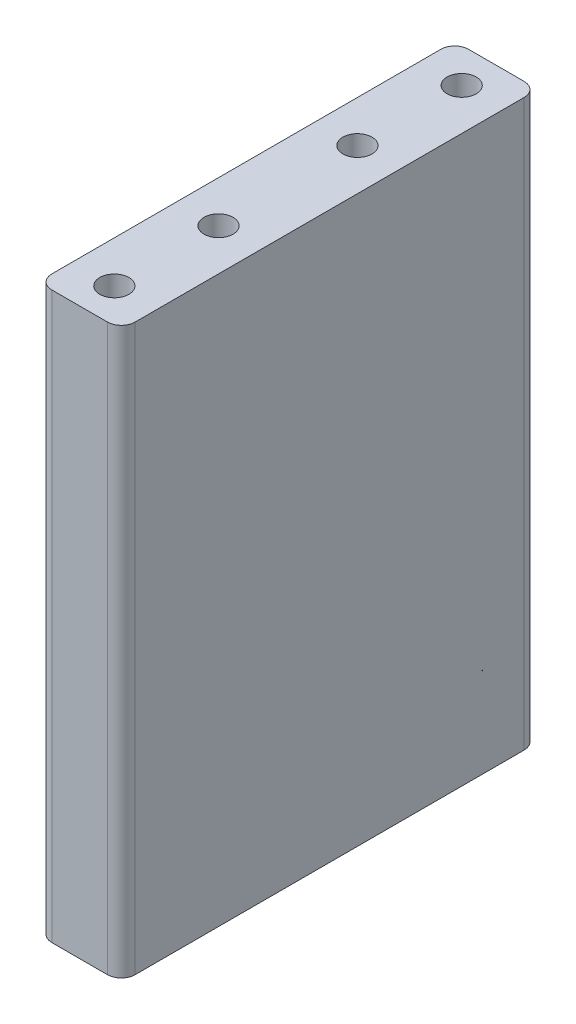
from build123d import *

# Parameters (mm, degrees)
SKETCH1_W                   = 12
SKETCH1_H                   = 60
BOSS_EXTRUDE1_DEPTH         = 81.375
TAP_DRILL_FOR_M5X0_8_TAP1_D = 4.2
FILLET1_R                   = 2


with BuildPart() as part:
    # Sketch1 → Boss-Extrude1 (new body)
    with BuildSketch(Plane(origin=(0, 0, 0), x_dir=(1, 0, 0), z_dir=(0, 1, 0))):
        Rectangle(SKETCH1_W, SKETCH1_H)
    extrude(amount=-BOSS_EXTRUDE1_DEPTH)

    # Tap Drill for M5x0.8 Tap1 (through all)
    with Locations(Plane(origin=(0, 0, -10), x_dir=(0, 0, 1), z_dir=(0, 1, 0))):
        with Locations((0, 0), (20, 0), (-15, 0), (35, 0)):
            Hole(TAP_DRILL_FOR_M5X0_8_TAP1_D / 2)

    # Fillet1
    fillet1_edges = [part.edges().sort_by_distance(p)[0] for p in [
        (-6, -40.6875, -30),
        (-6, -40.6875, 30),
        (6, -40.6875, 30),
        (6, -40.6875, -30),
    ]]
    fillet(fillet1_edges, radius=FILLET1_R)


solid = part.part
